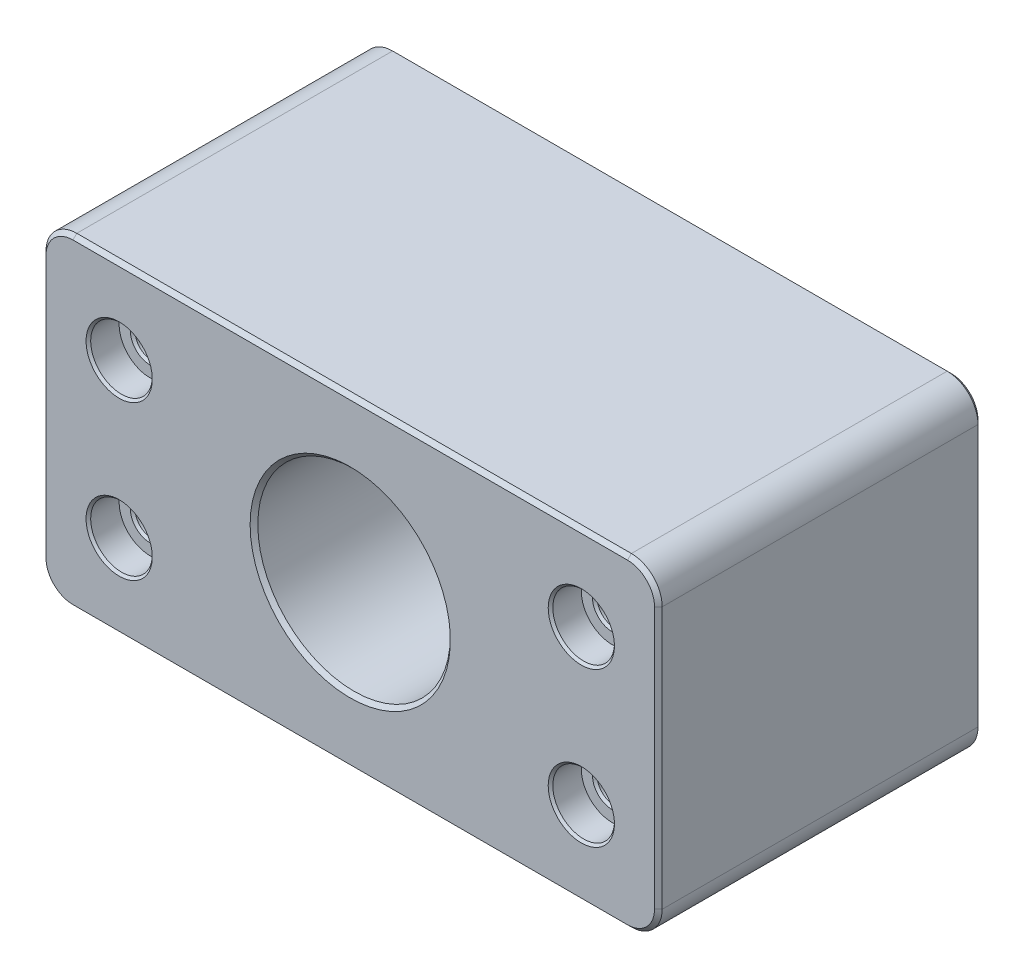
from build123d import *

# Parameters (mm, degrees)
SKETCH1_W                      = 80
SKETCH1_H                      = 42
BOSS_EXTRUDE1_DEPTH            = 42
FILLET1_R                      = 4
CHAMFER1_SIZE                  = 0.5
CBORE_FOR_M4_SHCS1_D           = 4.5
CBORE_FOR_M4_SHCS1_CBORE_D     = 8
CBORE_FOR_M4_SHCS1_CBORE_DEPTH = 4
SKETCH5_R                      = 12.5
CUT_EXTRUDE2_DEPTH             = 62.684682053
CHAMFER2_SIZE                  = 0.5
CHAMFER3_SIZE                  = 0.3


with BuildPart() as part:
    # Sketch1 → Boss-Extrude1 (new body)
    with BuildSketch(Plane.XY):
        Rectangle(SKETCH1_W, SKETCH1_H)
    extrude(amount=BOSS_EXTRUDE1_DEPTH)

    # Fillet1
    fillet1_edges = [part.edges().sort_by_distance(p)[0] for p in [
        (40, -21, 21),
        (-40, -21, 21),
        (-40, 21, 21),
        (40, 21, 21),
    ]]
    fillet(fillet1_edges, radius=FILLET1_R)

    # Chamfer1
    chamfer1_edges = [part.edges().sort_by_distance(p)[0] for p in [
        (40, 0, 0),
        (40, 0, 42),
        (0, -21, 0),
        (-40, 0, 0),
        (0, 21, 0),
        (-38.828427125, 19.828427125, 0),
        (38.828427125, 19.828427125, 0),
        (-38.828427125, -19.828427125, 0),
        (38.828427125, -19.828427125, 0),
        (0, -21, 42),
        (0, 21, 42),
        (-40, 0, 42),
        (-38.828427125, 19.828427125, 42),
        (38.828427125, 19.828427125, 42),
        (-38.828427125, -19.828427125, 42),
        (38.828427125, -19.828427125, 42),
    ]]
    chamfer(chamfer1_edges, length=CHAMFER1_SIZE)

    # CBORE for M4 SHCS1 (through all)
    with Locations(Plane.XY.offset(42)):
        with Locations((-30, 10), (30, 10), (30, -10), (-30, -10)):
            CounterBoreHole(CBORE_FOR_M4_SHCS1_D / 2, CBORE_FOR_M4_SHCS1_CBORE_D / 2, CBORE_FOR_M4_SHCS1_CBORE_DEPTH)

    # Sketch5 → Cut-Extrude2 (cut, through all)
    with BuildSketch(Plane(origin=(0, 0, 0), x_dir=(-1, 0, 0), z_dir=(0, 0, -1))):
        Circle(SKETCH5_R)
    extrude(amount=-CUT_EXTRUDE2_DEPTH, mode=Mode.SUBTRACT)

    # Chamfer2
    chamfer2_edges = [part.edges().sort_by_distance(p)[0] for p in [
        (12.5, 0, 42),
        (12.5, 0, 0),
    ]]
    chamfer(chamfer2_edges, length=CHAMFER2_SIZE)

    # Chamfer3
    chamfer3_edges = [part.edges().sort_by_distance(p)[0] for p in [
        (26, 10, 42),
        (32.25, 10, 0),
        (32.25, 10, 38),
        (-34, 10, 42),
        (-27.75, 10, 0),
        (-27.75, 10, 38),
        (-34, -10, 42),
        (-27.75, -10, 0),
        (-27.75, -10, 38),
        (26, -10, 42),
        (32.25, -10, 0),
        (32.25, -10, 38),
    ]]
    chamfer(chamfer3_edges, length=CHAMFER3_SIZE)


solid = part.part
